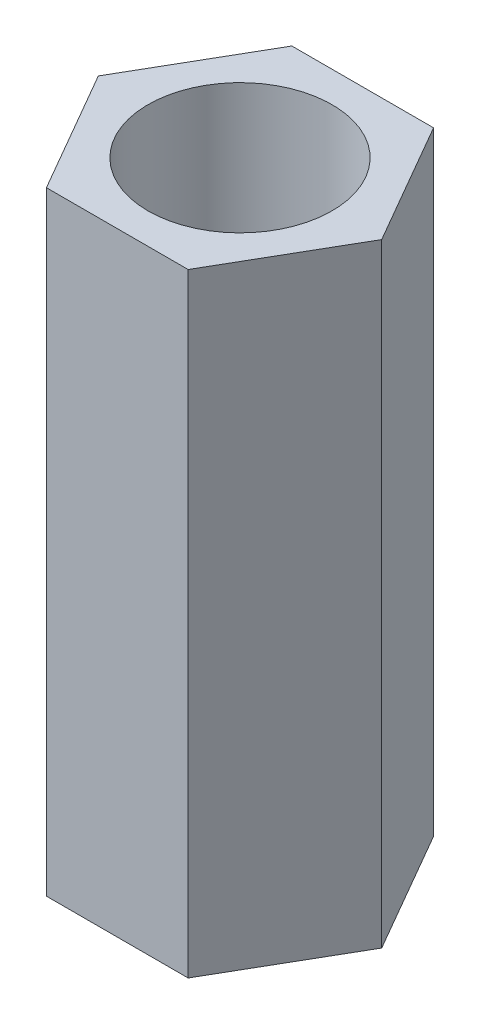
from build123d import *

# Parameters (mm, degrees)
EXTRUDE_1_DEPTH     = 10
SKETCH_2_R          = 1.5
CUT_EXTRUDE_1_DEPTH = 10


with BuildPart() as part:
    # 草图1 → 凸台-拉伸1 (new body)
    with BuildSketch(Plane(origin=(0, 0, 0), x_dir=(1, 0, 0), z_dir=(0, 1, 0))):
        Polygon((2.309401077, 0), (1.154700538, 2), (-1.154700538, 2), (-2.309401077, 0), (-1.154700538, -2), (1.154700538, -2), align=None)
    extrude(amount=EXTRUDE_1_DEPTH)

    # 草图2 → 切除-拉伸1 (cut)
    with BuildSketch(Plane(origin=(0, 10, 0), x_dir=(1, 0, 0), z_dir=(0, 1, 0))):
        with Locations(Location((0, 0, 0), (0, 0, 270))):
            Circle(SKETCH_2_R)
    extrude(amount=-CUT_EXTRUDE_1_DEPTH, mode=Mode.SUBTRACT)


solid = part.part
